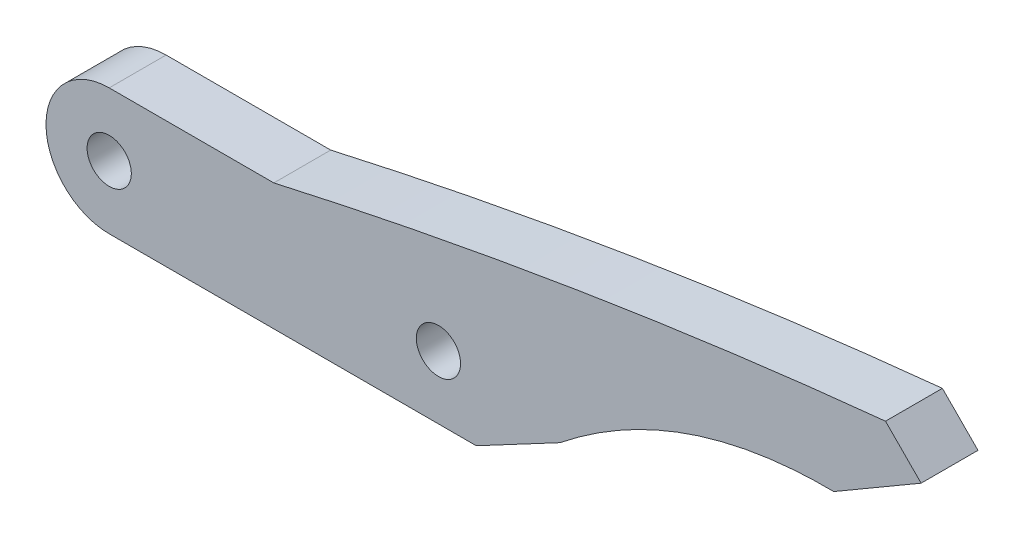
from build123d import *

# Parameters (mm, degrees)
SKETCH1_R           = 5
SKETCH1_R_2         = 1.75
BOSS_EXTRUDE1_DEPTH = 4.5
BOSS_EXTRUDE2_START = -4.5
BOSS_EXTRUDE2_DEPTH = 4.5


with BuildPart() as part:
    # Sketch1 → Boss-Extrude1 (new body)
    # profile 1 of 3: a face of its own
    with BuildSketch(Plane.XY):
        with Locations((-13.023088496, 0)):
            Circle(SKETCH1_R)
        with Locations((-13.023088496, 0)):
            Circle(SKETCH1_R_2, mode=Mode.SUBTRACT)
    # profile 2 of 3: a face of its own
    with BuildSketch(Plane.XY):
        with Locations((13.023088496, 0)):
            Circle(SKETCH1_R)
        with Locations((13.023088496, 0)):
            Circle(SKETCH1_R_2, mode=Mode.SUBTRACT)
    # profile 3 of 3: a face of its own
    with BuildSketch(Plane.XY):
        with BuildLine():
            Line((-13.023088477, -5), (13.023088496, -5))
            ThreePointArc((13.023088496, -5), (8.023088496, 0), (13.023088496, 5))
            Line((13.023088496, 5), (-13.02308848, 5))
            ThreePointArc((-13.02308848, 5), (-9.487554585, 3.5355339), (-8.023088496, 0))
            ThreePointArc((-8.023088496, 0), (-9.487554584, -3.535533899), (-13.023088477, -5))
        make_face()
    extrude(amount=BOSS_EXTRUDE1_DEPTH)

    # Sketch2 → Boss-Extrude2 (add)
    with BuildSketch(Plane.XY.offset(4.5).offset(BOSS_EXTRUDE2_START)):
        with BuildLine():
            Line((48.387077696, 12.87), (51.203884398, 10.03))
            Line((51.203884398, 10.03), (44.293088496, 6))
            add(Edge.make_bspline(
                [(44.293088496, 6), (32.169239244, 6.157348305), (22.633088496, -1.48)],
                knots=[0, 0, 0, 1, 1, 1], degree=2))
            Line((22.633088496, -1.48), (16.013088496, -5))
            Line((16.013088496, -5), (13.023088496, -5))
            ThreePointArc((13.023088496, -5), (18.023088496, 0), (13.023088496, 5))
            Line((13.023088496, 5), (0, 5))
            add(Edge.make_bspline(
                [(0, 5), (23.957075796, 10.418061583), (48.387077696, 12.87)],
                knots=[0, 0, 0, 1, 1, 1], degree=2))
        make_face()
    extrude(amount=BOSS_EXTRUDE2_DEPTH)


solid = part.part
